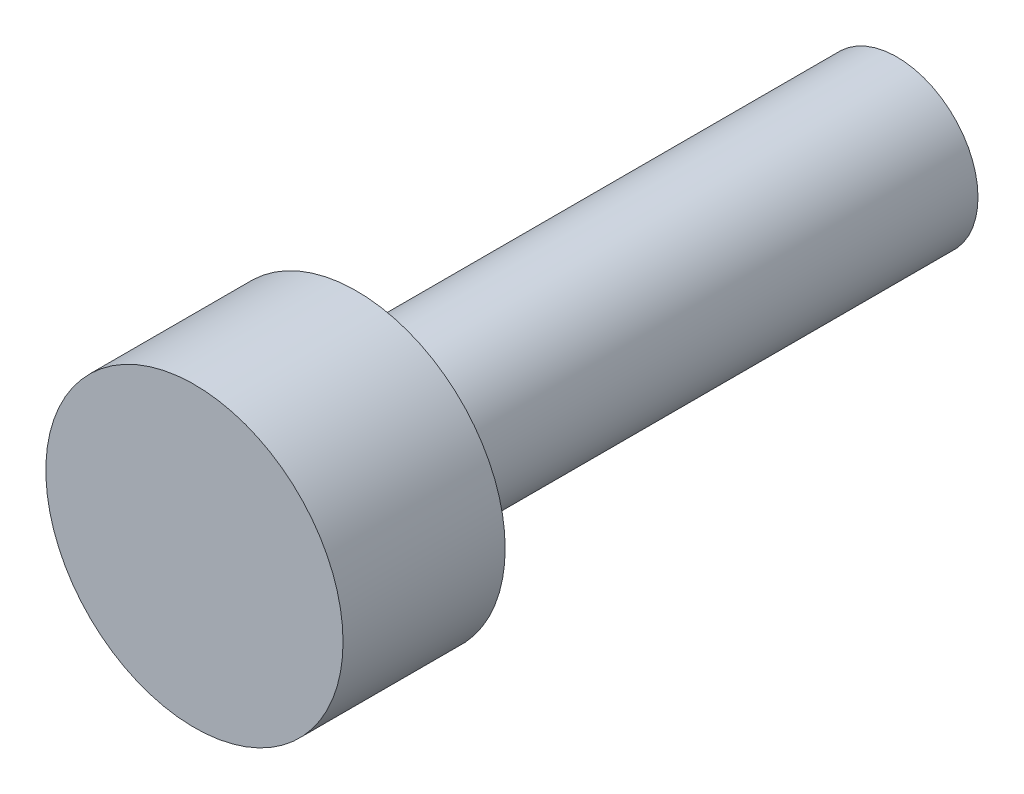
from build123d import *

# Parameters (mm, degrees)
SKETCH_1_R        = 1.5
M3X10_DEPTH       = 10
EXTRUDE_START     = 10
SKETCH_2_R        = 2.75
EXTRUDE_265_DEPTH = 3


with BuildPart() as part:
    # 草图1 → M3x10螺杆 (new body)
    with BuildSketch(Plane.XY):
        Circle(SKETCH_1_R)
    extrude(amount=M3X10_DEPTH)

    # 草图2 → Extrude 265 (add)
    with BuildSketch(Plane.XY.offset(EXTRUDE_START)):
        Circle(SKETCH_2_R)
    extrude(amount=EXTRUDE_265_DEPTH)


solid = part.part
